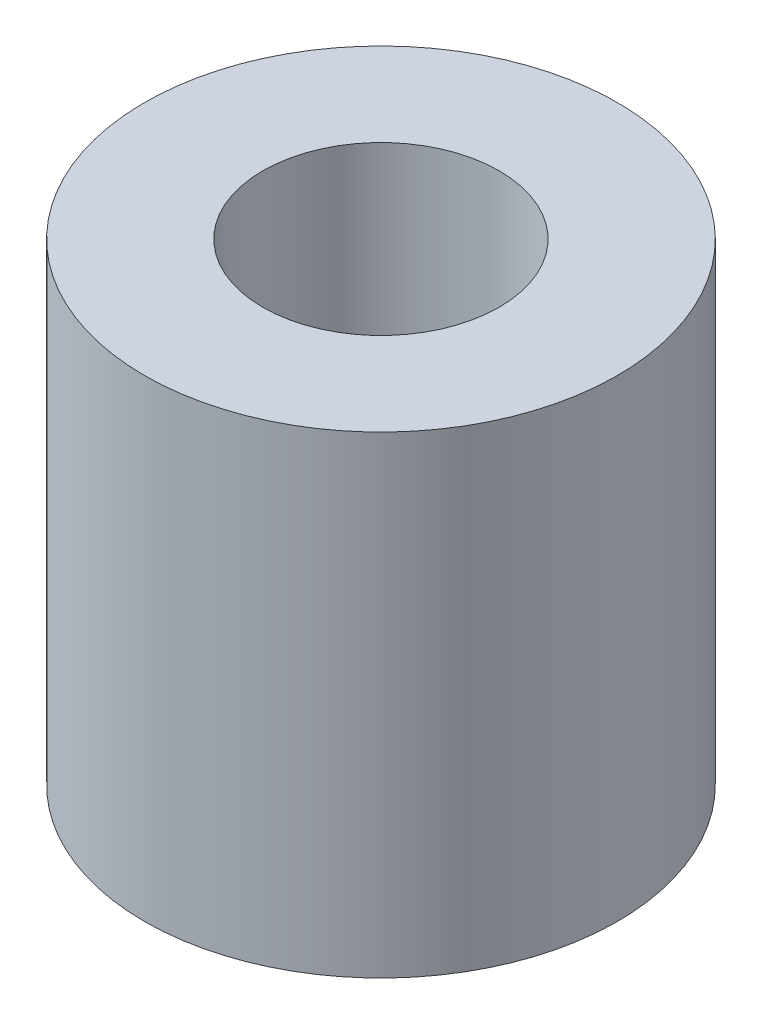
from build123d import *

# Parameters (mm, degrees)
SKETCH_1_R      = 3.5
SKETCH_1_R_2    = 1.75
EXTRUDE_1_DEPTH = 7


with BuildPart() as part:
    # Эскиз1 → Бобышка-Вытянуть1 (new body)
    with BuildSketch(Plane(origin=(0, 0, 0), x_dir=(1, 0, 0), z_dir=(0, 1, 0))):
        with Locations(Location((0, 0, 0), (0, 0, 270))):
            Circle(SKETCH_1_R)
        with Locations(Location((0, 0, 0), (0, 0, 270))):
            Circle(SKETCH_1_R_2, mode=Mode.SUBTRACT)
    extrude(amount=EXTRUDE_1_DEPTH)


solid = part.part
